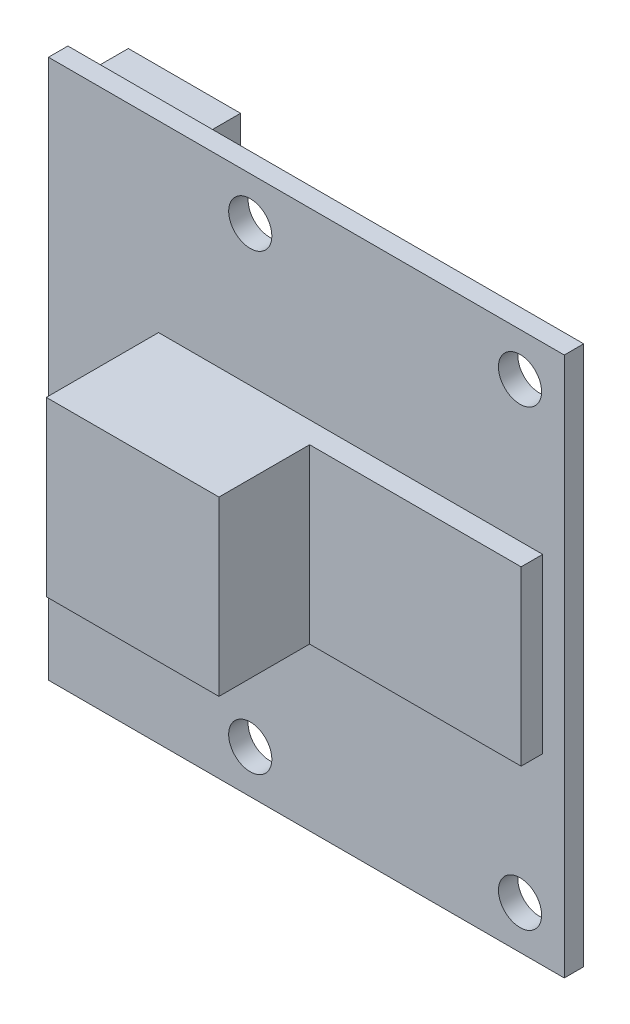
from build123d import *

# Parameters (mm, degrees)
CROQUIS2_W                    = 23.9
CROQUIS2_H                    = 12.5
SALIENTE_EXTRUIR1_DEPTH       = 0.9
CROQUIS4_W                    = 17.8
CROQUIS4_H                    = 4
SALIENTE_EXTRUIR2_DEPTH       = 1
CROQUIS5_W                    = 8
CROQUIS5_H                    = 4
SALIENTE_EXTRUIR3_DEPTH       = 4.2
CROQUIS6_W                    = 5.2
CROQUIS6_H                    = 11
SALIENTE_EXTRUIR4_DEPTH       = 2.8
DI_METRO_DE_TALADRO_2_0_2_1_D = 2


with BuildPart() as part:
    # Croquis2 → Saliente-Extruir1 (new body)
    with BuildSketch(Plane.XY):
        with Locations((0.45, 6.25)):
            Rectangle(CROQUIS2_W, CROQUIS2_H)
    saliente_extruir1 = extrude(amount=SALIENTE_EXTRUIR1_DEPTH)

    # Croquis4 → Saliente-Extruir2 (add)
    with BuildSketch(Plane.XY.offset(0.9)):
        with Locations((2.5, 2)):
            Rectangle(CROQUIS4_W, CROQUIS4_H)
    saliente_extruir2 = extrude(amount=SALIENTE_EXTRUIR2_DEPTH)

    # Croquis5 → Saliente-Extruir3 (add)
    with BuildSketch(Plane.XY.offset(1.9)):
        with Locations((-2.4, 2)):
            Rectangle(CROQUIS5_W, CROQUIS5_H)
    saliente_extruir3 = extrude(amount=SALIENTE_EXTRUIR3_DEPTH)

    # Croquis6 → Saliente-Extruir4 (add)
    with BuildSketch(Plane(origin=(0, 0, 0), x_dir=(-1, 0, 0), z_dir=(0, 0, -1))):
        with Locations((8.9, 5.5)):
            Rectangle(CROQUIS6_W, CROQUIS6_H)
    saliente_extruir4 = extrude(amount=SALIENTE_EXTRUIR4_DEPTH)

    # Diámetro de taladro Ø2.0 (2)1 (through all)
    with Locations(Plane(origin=(-2.15, 10.5, 0.9), x_dir=(1, 0, 0), z_dir=(0, 0, 1))):
        with Locations((0, 0), (12.5, 0)):
            di_metro_de_taladro_2_0_2_1 = Hole(DI_METRO_DE_TALADRO_2_0_2_1_D / 2)

    # Simetría1: Saliente-Extruir1, Saliente-Extruir2, Saliente-Extruir3, Saliente-Extruir4 across plane
    add(saliente_extruir1.mirror(Plane.ZX))
    add(saliente_extruir2.mirror(Plane.ZX))
    add(saliente_extruir3.mirror(Plane.ZX))
    add(saliente_extruir4.mirror(Plane.ZX))

    # Simetría2: Diámetro de taladro Ø2.0 (2)1 across plane
    add(di_metro_de_taladro_2_0_2_1.mirror(Plane.ZX), mode=Mode.SUBTRACT)


solid = part.part
